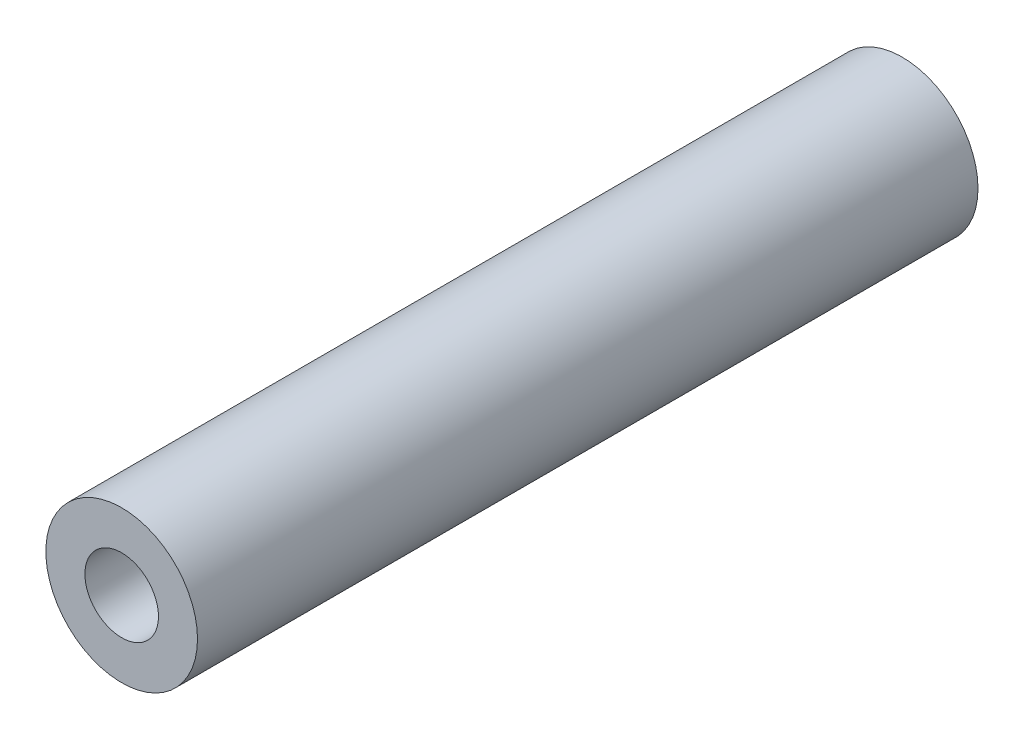
from build123d import *

# Parameters (mm, degrees)
M3_SLEEVE_PROFILE_R   = 3.4
M3_SLEEVE_PROFILE_R_2 = 1.65
M3_SLEEVE_DEPTH       = 35


with BuildPart() as part:
    # M3 sleeve profile → M3 sleeve (new body)
    with BuildSketch(Plane.XY):
        Circle(M3_SLEEVE_PROFILE_R)
        Circle(M3_SLEEVE_PROFILE_R_2, mode=Mode.SUBTRACT)
    extrude(amount=M3_SLEEVE_DEPTH)


solid = part.part
